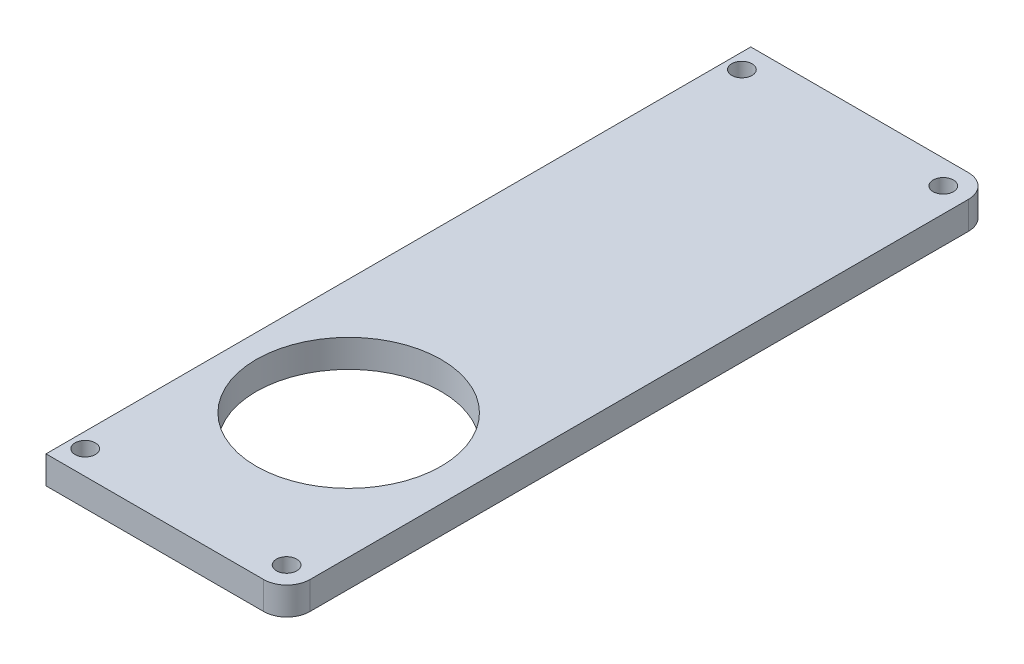
from build123d import *

# Parameters (mm, degrees)
SKETCH1_R           = 1.1
SKETCH1_R_2         = 10
BOSS_EXTRUDE1_DEPTH = 3


with BuildPart() as part:
    # Sketch1 → Boss-Extrude1 (new body)
    with BuildSketch(Plane(origin=(0, 0, 0), x_dir=(1, 0, 0), z_dir=(0, 1, 0))):
        with BuildLine():
            Line((-13.01875, -38.1), (10.51875, -38.1))
            ThreePointArc((10.51875, -38.1), (12.286516953, -37.367766953), (13.01875, -35.6))
            Line((13.01875, -35.6), (13.01875, 35.6))
            ThreePointArc((13.01875, 35.6), (12.286516953, 37.367766953), (10.51875, 38.1))
            Line((10.51875, 38.1), (-13.01875, 38.1))
            Line((-13.01875, 38.1), (-13.01875, -38.1))
        make_face()
        with Locations(Location((-11.38125, 35.5, 0), (0, 0, 270))):
            Circle(SKETCH1_R, mode=Mode.SUBTRACT)
        with Locations(Location((10.39375, 35.5, 0), (0, 0, 270))):
            Circle(SKETCH1_R, mode=Mode.SUBTRACT)
        with Locations(Location((-11.38125, -35.5, 0), (0, 0, 270))):
            Circle(SKETCH1_R, mode=Mode.SUBTRACT)
        with Locations(Location((10.39375, -35.5, 0), (0, 0, 270))):
            Circle(SKETCH1_R, mode=Mode.SUBTRACT)
        with Locations(Location((-0.49375, -17.9, 0), (0, 0, 270))):
            Circle(SKETCH1_R_2, mode=Mode.SUBTRACT)
    extrude(amount=BOSS_EXTRUDE1_DEPTH)


solid = part.part
